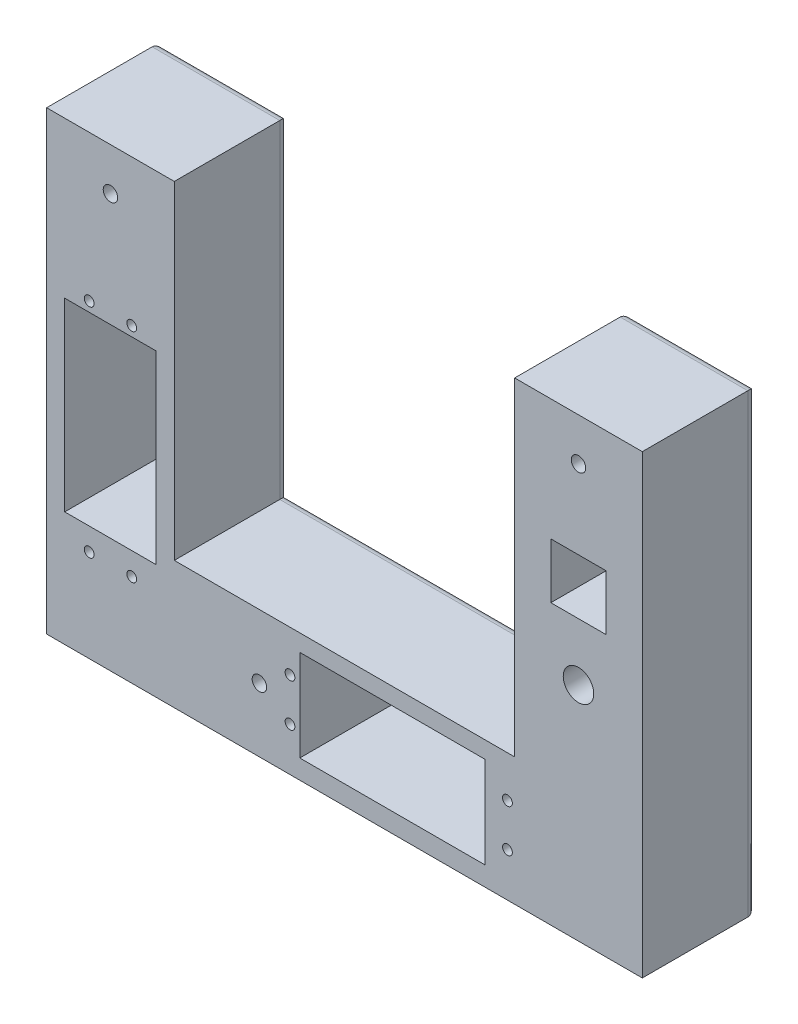
from build123d import *

# Parameters (mm, degrees)
BOSS_EXTRUDE1_DEPTH            = 26.8
SKETCH2_W                      = 21.5
SKETCH2_H                      = 43.5
SKETCH2_W_2                    = 43.5
SKETCH2_H_2                    = 21.5
CUT_EXTRUDE1_DEPTH             = 169.899357105
SKETCH3_R                      = 1.15
BOSS_EXTRUDE2_DEPTH            = 26.8
SKETCH3_2_R                    = 1.15
CUT_EXTRUDE2_DEPTH             = 169.899357105
SKETCH4_R                      = 1.15
CUT_EXTRUDE3_DEPTH             = 169.899357105
FILLET2_R                      = 2
CBORE_FOR_M3_SHCS1_D           = 3.4
CBORE_FOR_M3_SHCS1_CBORE_D     = 6.5
CBORE_FOR_M3_SHCS1_CBORE_DEPTH = 3
SKETCH12_W                     = 14
SKETCH12_H                     = 14
CUT_EXTRUDE5_DEPTH             = 10
SKETCH13_W                     = 13
SKETCH13_H                     = 13
CUT_EXTRUDE6_DEPTH             = 168.603677855
SKETCH14_R                     = 3.585
CUT_EXTRUDE7_DEPTH             = 169.899357105


with BuildPart() as part:
    # Sketch1 → Boss-Extrude1 (new body)
    with BuildSketch(Plane.XY):
        Polygon((85.79616933, 12.865007186), (115.79616933, 12.865007186), (115.79616933, 119.999999996), (85.79616933, 119.999999996), (85.79616933, 42.865007186), (5.79616933, 42.865007186), (5.79616933, 119.999999996), (-24.20383067, 119.999999996), (-24.20383067, 12.865007186), (5.79616933, 12.865007186), align=None)
    extrude(amount=BOSS_EXTRUDE1_DEPTH)

    # Sketch2 → Cut-Extrude1 (cut, through all)
    with BuildSketch(Plane.XY.offset(26.8)):
        with Locations((-9.20383067, 61.615007186)):
            Rectangle(SKETCH2_W, SKETCH2_H)
        with Locations((57.04616933, 28.145492547)):
            Rectangle(SKETCH2_W_2, SKETCH2_H_2)
    extrude(amount=-CUT_EXTRUDE1_DEPTH, mode=Mode.SUBTRACT)

    # Sketch3 → Boss-Extrude2 (add, through all)
    with BuildSketch(Plane.XY.offset(26.8)):
        with Locations((-14.20383067, 34.565007186)):
            Circle(SKETCH3_R)
        with Locations((-4.20383067, 34.565007186)):
            Circle(SKETCH3_R)
        with Locations((-14.20383067, 85.665007186)):
            Circle(SKETCH3_R)
        with Locations((-4.20383067, 85.665007186)):
            Circle(SKETCH3_R)
    extrude(amount=-BOSS_EXTRUDE2_DEPTH)

    # Sketch3<2> → Cut-Extrude2 (cut, through all)
    with BuildSketch(Plane.XY.offset(26.8)):
        with Locations((-14.20383067, 34.565007186)):
            Circle(SKETCH3_2_R)
        with Locations((-4.20383067, 34.565007186)):
            Circle(SKETCH3_2_R)
        with Locations((-14.20383067, 85.665007186)):
            Circle(SKETCH3_2_R)
        with Locations(Location((-4.20383067, 85.665007186, 0), (0, 0, 180))):
            Circle(SKETCH3_2_R)
    extrude(amount=-CUT_EXTRUDE2_DEPTH, mode=Mode.SUBTRACT)

    # Sketch4 → Cut-Extrude3 (cut, through all)
    with BuildSketch(Plane.XY.offset(26.8)):
        with Locations((84.09616933, 23.145492547)):
            Circle(SKETCH4_R)
        with Locations(Location((84.09616933, 33.145492547, 0), (0, 0, 180))):
            Circle(SKETCH4_R)
        with Locations((32.99616933, 23.145492547)):
            Circle(SKETCH4_R)
        with Locations(Location((32.99616933, 33.145492547, 0), (0, 0, 180))):
            Circle(SKETCH4_R)
    extrude(amount=-CUT_EXTRUDE3_DEPTH, mode=Mode.SUBTRACT)

    # Fillet2
    fillet2_edges = [part.edges().sort_by_distance(p)[0] for p in [
        (85.79616933, 81.432503591, 0),
        (100.79616933, 119.999999996, 0),
        (115.79616933, 66.432503591, 0),
        (45.79616933, 12.865007186, 0),
        (-24.20383067, 66.432503591, 0),
        (-9.20383067, 119.999999996, 0),
        (5.79616933, 81.432503591, 0),
        (45.79616933, 42.865007186, 0),
    ]]
    fillet(fillet2_edges, radius=FILLET2_R)

    # CBORE for M3 SHCS1 (through all)
    with Locations(Plane(origin=(0, 0, 0), x_dir=(-1, 0, 0), z_dir=(0, 0, -1))):
        with Locations((-25.79616933, 27.865007186), (9.20383067, 109.999999996), (-100.79616933, 109.999999996)):
            CounterBoreHole(CBORE_FOR_M3_SHCS1_D / 2, CBORE_FOR_M3_SHCS1_CBORE_D / 2, CBORE_FOR_M3_SHCS1_CBORE_DEPTH)

    # Sketch12 → Cut-Extrude5 (cut)
    with BuildSketch(Plane(origin=(0, 0, 0), x_dir=(-1, 0, 0), z_dir=(0, 0, -1))):
        with Locations((-100.79616933, 84.999999996)):
            Rectangle(SKETCH12_W, SKETCH12_H)
    extrude(amount=-CUT_EXTRUDE5_DEPTH, mode=Mode.SUBTRACT)

    # Sketch13 → Cut-Extrude6 (cut, through all)
    with BuildSketch(Plane(origin=(0, 0, 10), x_dir=(-1, 0, 0), z_dir=(0, 0, -1))):
        with Locations((-100.79616933, 84.999999996)):
            Rectangle(SKETCH13_W, SKETCH13_H)
    extrude(amount=-CUT_EXTRUDE6_DEPTH, mode=Mode.SUBTRACT)

    # Sketch14 → Cut-Extrude7 (cut, through all)
    with BuildSketch(Plane(origin=(0, 0, 0), x_dir=(-1, 0, 0), z_dir=(0, 0, -1))):
        with Locations((-100.79616933, 64.999999996)):
            Circle(SKETCH14_R)
    extrude(amount=-CUT_EXTRUDE7_DEPTH, mode=Mode.SUBTRACT)


solid = part.part
